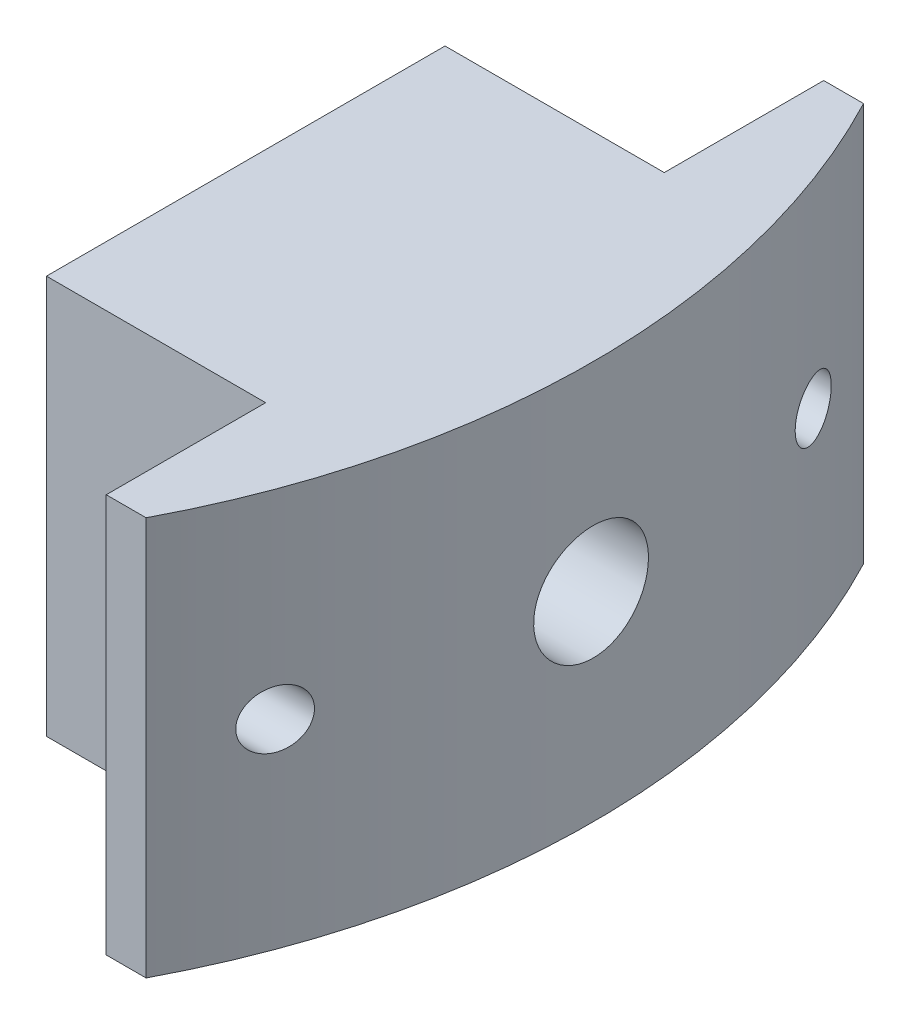
from build123d import *

# Parameters (mm, degrees)
SKETCH2_W               = 13.97
SKETCH2_H               = 25.4
BOSS_EXTRUDE1_DEPTH     = 25.4
CUT_EXTRUDE2_REACH      = 42.718
CUT_EXTRUDE2_END_RADIUS = 49.2125
SKETCH4_R               = 1.27
CUT_EXTRUDE4_START      = -8.171649
SKETCH11_R              = 3.6576
CUT_EXTRUDE4_DEPTH      = 12.7
CUT_EXTRUDE5_REACH      = 61.913
CUT_EXTRUDE5_END_RADIUS = 49.2125
SKETCH15_R              = 1.8288


with BuildPart() as part:
    # Sketch2 → Boss-Extrude1 (new body)
    with BuildSketch(Plane(origin=(0, 0, 0), x_dir=(1, 0, 0), z_dir=(0, 1, 0))):
        with Locations((34.055850798, 0)):
            Rectangle(SKETCH2_W, SKETCH2_H)
        Polygon((43.580850798, -22.86), (43.580850798, 22.86), (41.040850798, 22.86), (41.040850798, 12.7), (41.040850798, -12.7), (41.040850798, -22.86), align=None)
        with BuildLine():
            Line((43.580850798, 22.86), (43.580850798, -22.86))
            ThreePointArc((43.580850798, -22.86), (49.2125, 0), (43.580850798, 22.86))
        make_face()
    extrude(amount=BOSS_EXTRUDE1_DEPTH)

    # Cut-Extrude2: up to this cylinder (the profile starts inside it)
    cut_extrude2_end = Plane(origin=(0, 12.7, 0), z_dir=(0, -1, 0)) * Cylinder(CUT_EXTRUDE2_END_RADIUS, 184.861, mode=Mode.PRIVATE)
    # Sketch4 → Cut-Extrude2 (cut, up to the surface)
    with BuildSketch(Plane.ZY.offset(-27.070850798), mode=Mode.PRIVATE) as cut_extrude2_sk1:
        with Locations((0, 12.7)):
            Circle(SKETCH4_R)
    cut_extrude2_tool1 = extrude(cut_extrude2_sk1.sketch, amount=-CUT_EXTRUDE2_REACH, mode=Mode.PRIVATE) & cut_extrude2_end
    add(cut_extrude2_tool1.solids().sort_by_distance((27.070851, 12.7, 0))[0], mode=Mode.SUBTRACT)

    # Sketch11 → Cut-Extrude4 (cut)
    with BuildSketch(Plane.ZY.offset(-41.040850798).offset(CUT_EXTRUDE4_START)):
        with Locations(Location((0, 12.7, 0), (0, 0, 180))):
            Circle(SKETCH11_R)
    extrude(amount=CUT_EXTRUDE4_DEPTH, mode=Mode.SUBTRACT)

    # Cut-Extrude5: up to this cylinder (the profile starts inside it)
    cut_extrude5_end = Plane(origin=(0, 12.7, 0), z_dir=(0, -1, 0)) * Cylinder(CUT_EXTRUDE5_END_RADIUS, 224.803334, mode=Mode.PRIVATE)
    # Sketch15 → Cut-Extrude5 (cut, up to the surface)
    with BuildSketch(Plane(origin=(0, 0, 0), x_dir=(0, 0, -1), z_dir=(1, 0, 0)), mode=Mode.PRIVATE) as cut_extrude5_sk1:
        with BuildLine():
            ThreePointArc((-18.9738, 12.7), (-17.145, 10.8712), (-15.3162, 12.7))
            Line((-15.3162, 12.7), (-18.9738, 12.7))
        make_face()
    cut_extrude5_tool1 = extrude(cut_extrude5_sk1.sketch, amount=CUT_EXTRUDE5_REACH, mode=Mode.PRIVATE) & cut_extrude5_end
    add(cut_extrude5_tool1.solids().sort_by_distance((0, 11.923833, 17.145))[0], mode=Mode.SUBTRACT)
    # Sketch15 → Cut-Extrude5 (cut, up to the surface)
    with BuildSketch(Plane(origin=(0, 0, 0), x_dir=(0, 0, -1), z_dir=(1, 0, 0)), mode=Mode.PRIVATE) as cut_extrude5_sk2:
        with BuildLine():
            Line((-18.9738, 12.7), (-15.3162, 12.7))
            ThreePointArc((-15.3162, 12.7), (-17.145, 14.5288), (-18.9738, 12.7))
        make_face()
    cut_extrude5_tool2 = extrude(cut_extrude5_sk2.sketch, amount=CUT_EXTRUDE5_REACH, mode=Mode.PRIVATE) & cut_extrude5_end
    add(cut_extrude5_tool2.solids().sort_by_distance((0, 13.476167, 17.145))[0], mode=Mode.SUBTRACT)
    # Sketch15 → Cut-Extrude5 (cut, up to the surface)
    with BuildSketch(Plane(origin=(0, 0, 0), x_dir=(0, 0, -1), z_dir=(1, 0, 0)), mode=Mode.PRIVATE) as cut_extrude5_sk3:
        with Locations(Location((17.145, 12.7, 0), (0, 0, 180))):
            Circle(SKETCH15_R)
    cut_extrude5_tool3 = extrude(cut_extrude5_sk3.sketch, amount=CUT_EXTRUDE5_REACH, mode=Mode.PRIVATE) & cut_extrude5_end
    add(cut_extrude5_tool3.solids().sort_by_distance((0, 12.7, -17.145))[0], mode=Mode.SUBTRACT)


solid = part.part
